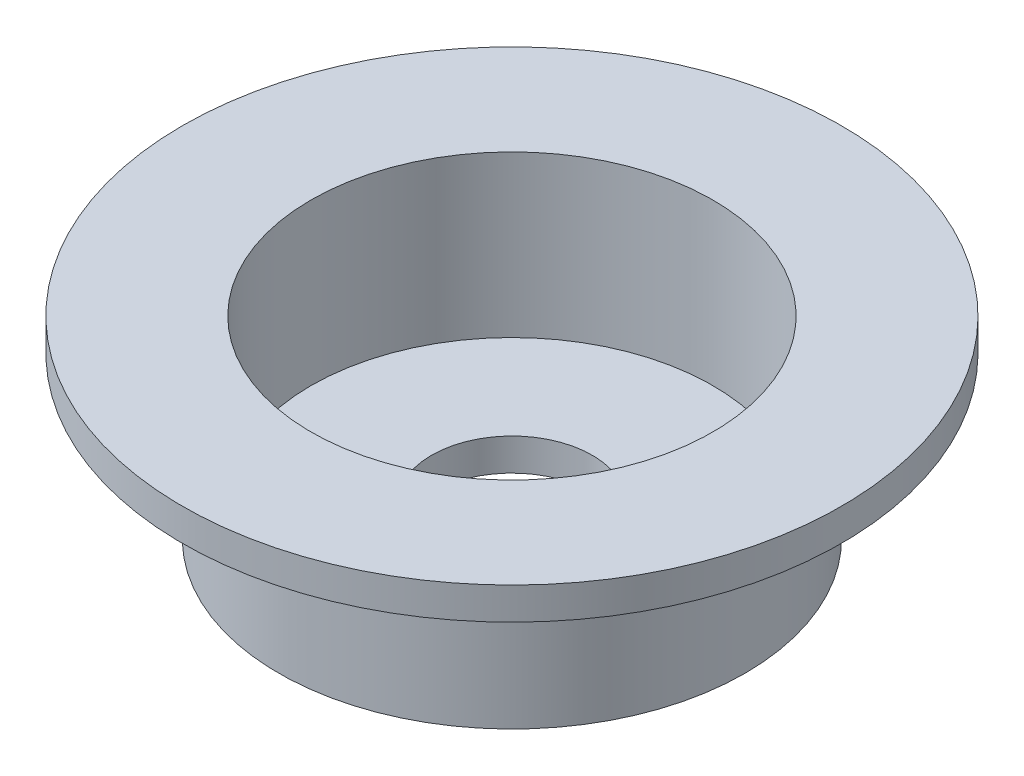
from build123d import *


with BuildPart() as part:
    # Sketch1 → Revolve1 (revolve)
    with BuildSketch(Plane.XY):
        Polygon((0, 0), (-8, 0), (-8, -2), (-2, -3), (-2, -12), (7.5, -12), (7.5, -10), (0, -10), align=None)
    revolve(axis=Axis((12.5, 0, 0), (0, -1, 0)))


solid = part.part
